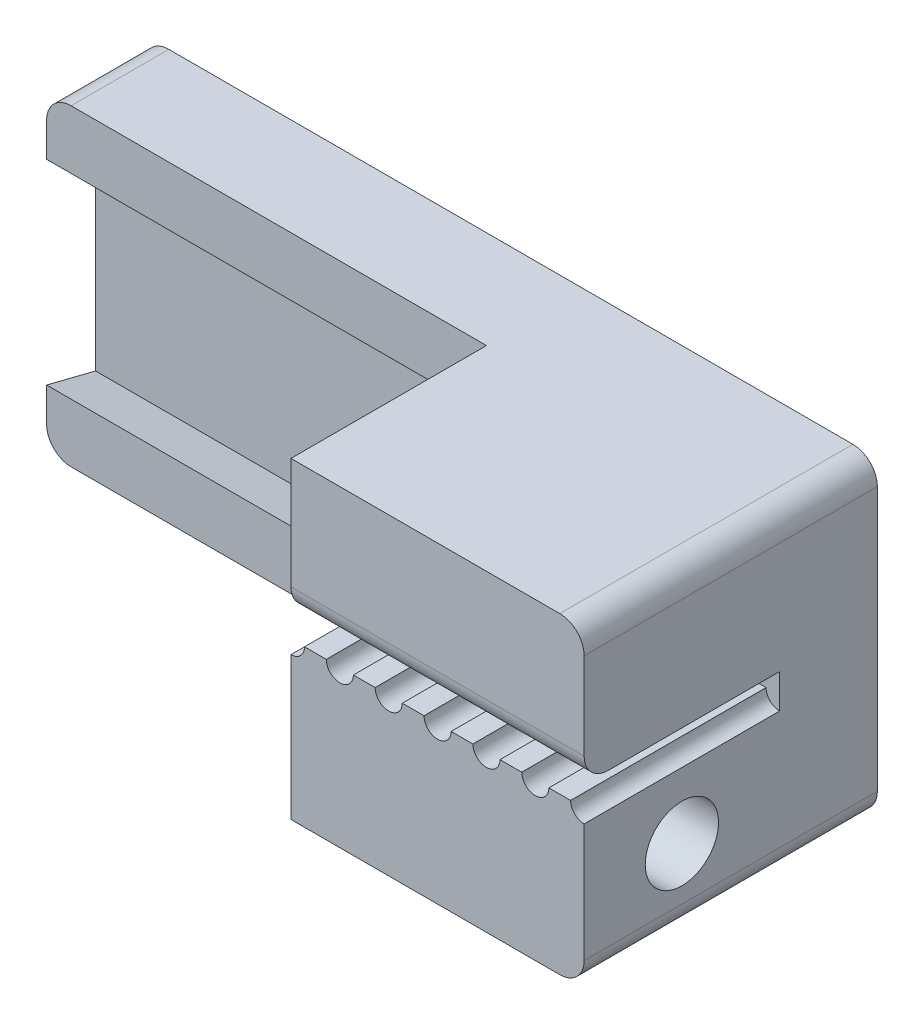
from build123d import *

# Parameters (mm, degrees)
BOSS_EXTRUDE1_DEPTH = 12
CUT_EXTRUDE1_DEPTH  = 8
FILLET1_R           = 1
CUT_EXTRUDE3_DEPTH  = 18
SKETCH6_R           = 1.5
CUT_EXTRUDE2_DEPTH  = 12


with BuildPart() as part:
    # Sketch4 → Boss-Extrude1 (new body)
    with BuildSketch(Plane.XY):
        with BuildLine():
            Line((12, 1.1), (12, 11.9))
            ThreePointArc((12, 11.9), (11.707106781, 12.607106781), (11, 12.9))
            Line((11, 12.9), (-17, 12.9))
            ThreePointArc((-17, 12.9), (-17.707106781, 12.607106781), (-18, 11.9))
            Line((-18, 11.9), (-18, 1.1))
            ThreePointArc((-18, 1.1), (-17.707106781, 0.392893219), (-17, 0.1))
            Line((-17, 0.1), (11, 0.1))
            ThreePointArc((11, 0.1), (11.707106781, 0.392893219), (12, 1.1))
        make_face()
    extrude(amount=BOSS_EXTRUDE1_DEPTH)

    # Sketch5 → Cut-Extrude1 (cut)
    with BuildSketch(Plane.XY.offset(12)):
        with BuildLine():
            Line((11.445, 6.5), (10.555, 6.5))
            ThreePointArc((10.555, 6.5), (10, 5.945), (9.445, 6.5))
            Line((9.445, 6.5), (8.555, 6.5))
            ThreePointArc((8.555, 6.5), (8, 5.945), (7.445, 6.5))
            Line((7.445, 6.5), (6.555, 6.5))
            ThreePointArc((6.555, 6.5), (6, 5.945), (5.445, 6.5))
            Line((5.445, 6.5), (4.555, 6.5))
            ThreePointArc((4.555, 6.5), (4, 5.945), (3.445, 6.5))
            Line((3.445, 6.5), (2.555, 6.5))
            ThreePointArc((2.555, 6.5), (2, 5.945), (1.445, 6.5))
            Line((1.445, 6.5), (0.555, 6.5))
            ThreePointArc((0.555, 6.5), (0.392444264, 6.107555736), (0, 5.945))
            Line((0, 5.945), (0, 7.345))
            Line((0, 7.345), (12, 7.345))
            Line((12, 7.345), (12, 5.945))
            ThreePointArc((12, 5.945), (11.607555736, 6.107555736), (11.445, 6.5))
        make_face()
    extrude(amount=-CUT_EXTRUDE1_DEPTH, mode=Mode.SUBTRACT)

    # Fillet1
    fillet1_edges = [part.edges().sort_by_distance(p)[0] for p in [
        (6, 7.345, 12),
    ]]
    fillet(fillet1_edges, radius=FILLET1_R)

    # Sketch7 → Cut-Extrude3 (cut)
    with BuildSketch(Plane.ZY.offset(18)):
        Polygon((4, 10.5), (4, 12.9), (12, 12.9), (12, 0.1), (4, 0.1), (4, 2.5), (2, 2), (2, 11), align=None)
    extrude(amount=-CUT_EXTRUDE3_DEPTH, mode=Mode.SUBTRACT)

    # Sketch6 → Cut-Extrude2 (cut)
    with BuildSketch(Plane.ZY.offset(-12)):
        with Locations((8, 3.25)):
            Circle(SKETCH6_R)
    extrude(amount=CUT_EXTRUDE2_DEPTH, mode=Mode.SUBTRACT)


solid = part.part
